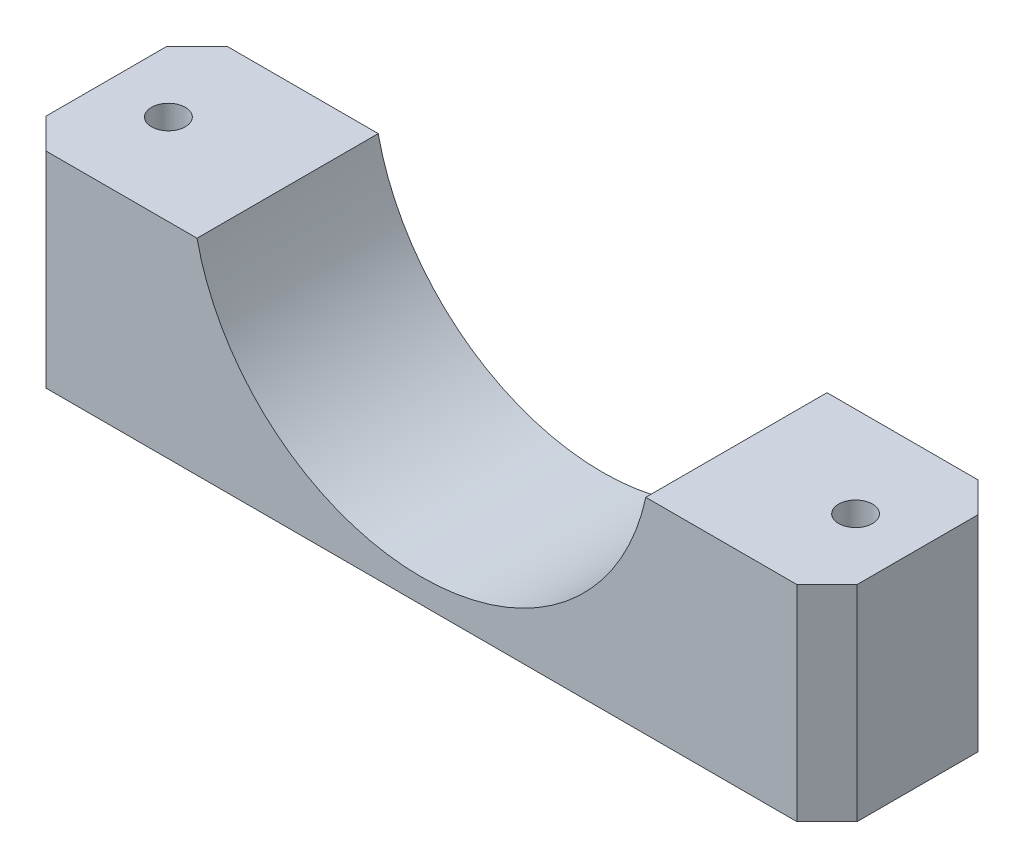
from build123d import *

# Parameters (mm, degrees)
BOSS_EXTRUDE1_DEPTH = 15
CHAMFER1_SIZE       = 2.5
SKETCH2_R           = 1.4
CUT_EXTRUDE1_DEPTH  = 41.512038564


with BuildPart() as part:
    # Sketch1 → Boss-Extrude1 (new body)
    with BuildSketch(Plane.XY):
        with BuildLine():
            Line((-18.574175621, -4), (-33.574175621, -4))
            Line((-33.574175621, -4), (-33.574175621, -21))
            Line((-33.574175621, -21), (33.574175621, -21))
            Line((33.574175621, -21), (33.574175621, -4))
            Line((33.574175621, -4), (18.574175621, -4))
            ThreePointArc((18.574175621, -4), (0, -19), (-18.574175621, -4))
        make_face()
    extrude(amount=BOSS_EXTRUDE1_DEPTH)

    # Chamfer1
    chamfer1_edges = [part.edges().sort_by_distance(p)[0] for p in [
        (-33.574175621, -12.5, 15),
        (33.574175621, -12.5, 15),
        (-33.574175621, -12.5, 0),
        (33.574175621, -12.5, 0),
    ]]
    chamfer(chamfer1_edges, length=CHAMFER1_SIZE)

    # Sketch2 → Cut-Extrude1 (cut, through all)
    with BuildSketch(Plane(origin=(0, -4, 0), x_dir=(1, 0, 0), z_dir=(0, 1, 0))):
        with Locations(Location((28.441617262, -7.5, 0), (0, 0, 180))):
            Circle(SKETCH2_R)
        with Locations((-28.441617262, -7.5)):
            Circle(SKETCH2_R)
    extrude(amount=-CUT_EXTRUDE1_DEPTH, mode=Mode.SUBTRACT)


solid = part.part
